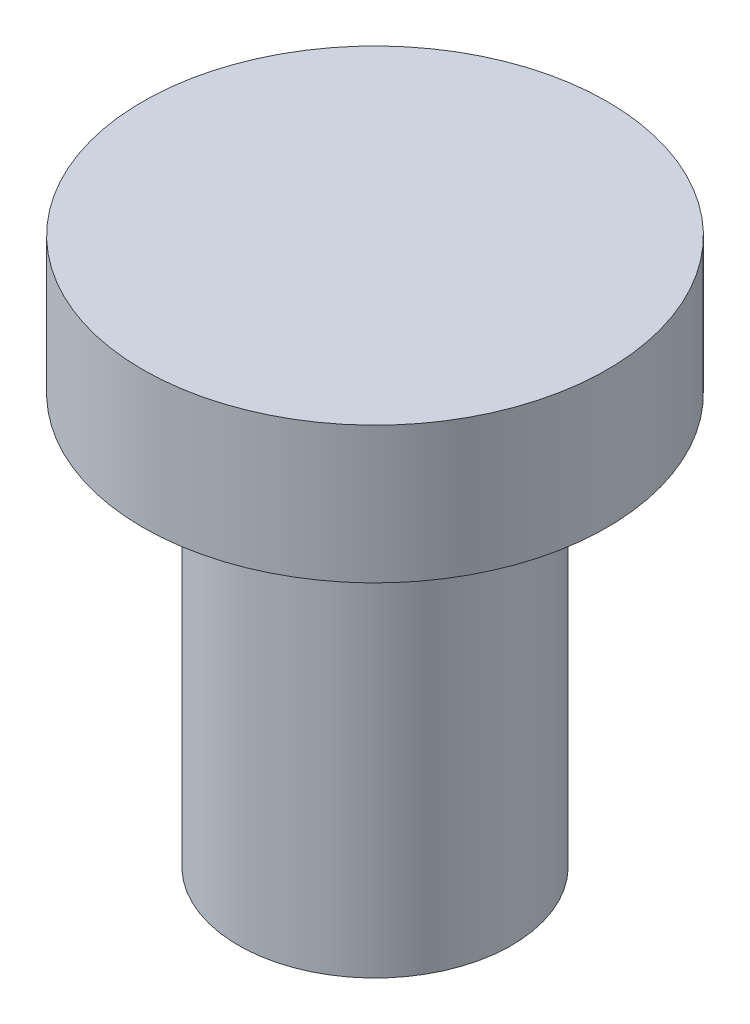
from build123d import *

# Parameters (mm, degrees)
SKETCH_1_R      = 1.7
EXTRUDE_1_DEPTH = 1
SKETCH_2_R      = 1
EXTRUDE_2_DEPTH = 3


with BuildPart() as part:
    # 스케치1 → 보스-돌출1 (new body)
    with BuildSketch(Plane(origin=(0, 0, 0), x_dir=(1, 0, 0), z_dir=(0, 1, 0))):
        with Locations(Location((0, 0, 0), (0, 0, 270))):
            Circle(SKETCH_1_R)
    extrude(amount=EXTRUDE_1_DEPTH)

    # 스케치2 → 보스-돌출2 (add)
    with BuildSketch(Plane.XZ):
        with Locations(Location((0, 0, 0), (0, 0, 270))):
            Circle(SKETCH_2_R)
    extrude(amount=EXTRUDE_2_DEPTH)


solid = part.part
